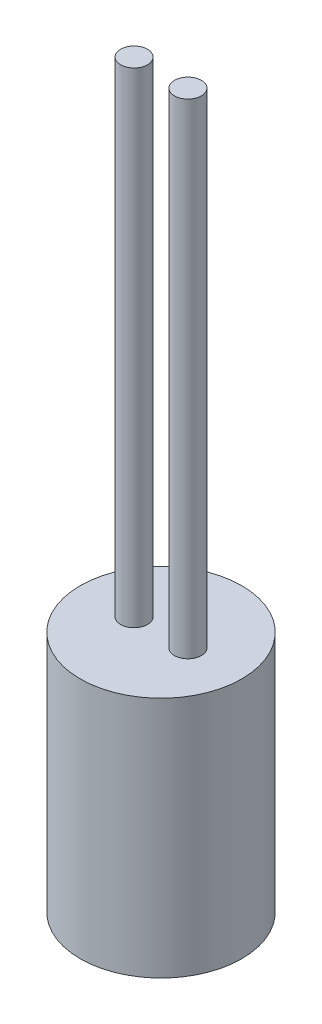
from build123d import *

# Parameters (mm, degrees)
SKETCH1_R  = 3
HEAD_DEPTH = 9
SKETCH2_R  = 0.5
PINS_DEPTH = 18


with BuildPart() as part:
    # Sketch1 → Head (new body)
    with BuildSketch(Plane(origin=(0, 0, 0), x_dir=(1, 0, 0), z_dir=(0, 1, 0))):
        with Locations(Location((0, 0, 0), (0, 0, 270))):
            Circle(SKETCH1_R)
    extrude(amount=-HEAD_DEPTH)

    # Sketch2 → Pins (add)
    with BuildSketch(Plane(origin=(0, 0, 0), x_dir=(1, 0, 0), z_dir=(0, 1, 0))):
        with Locations(Location((-1, 0, 0), (0, 0, 270))):
            Circle(SKETCH2_R)
        with Locations(Location((1, 0, 0), (0, 0, 270))):
            Circle(SKETCH2_R)
    extrude(amount=PINS_DEPTH)


solid = part.part
